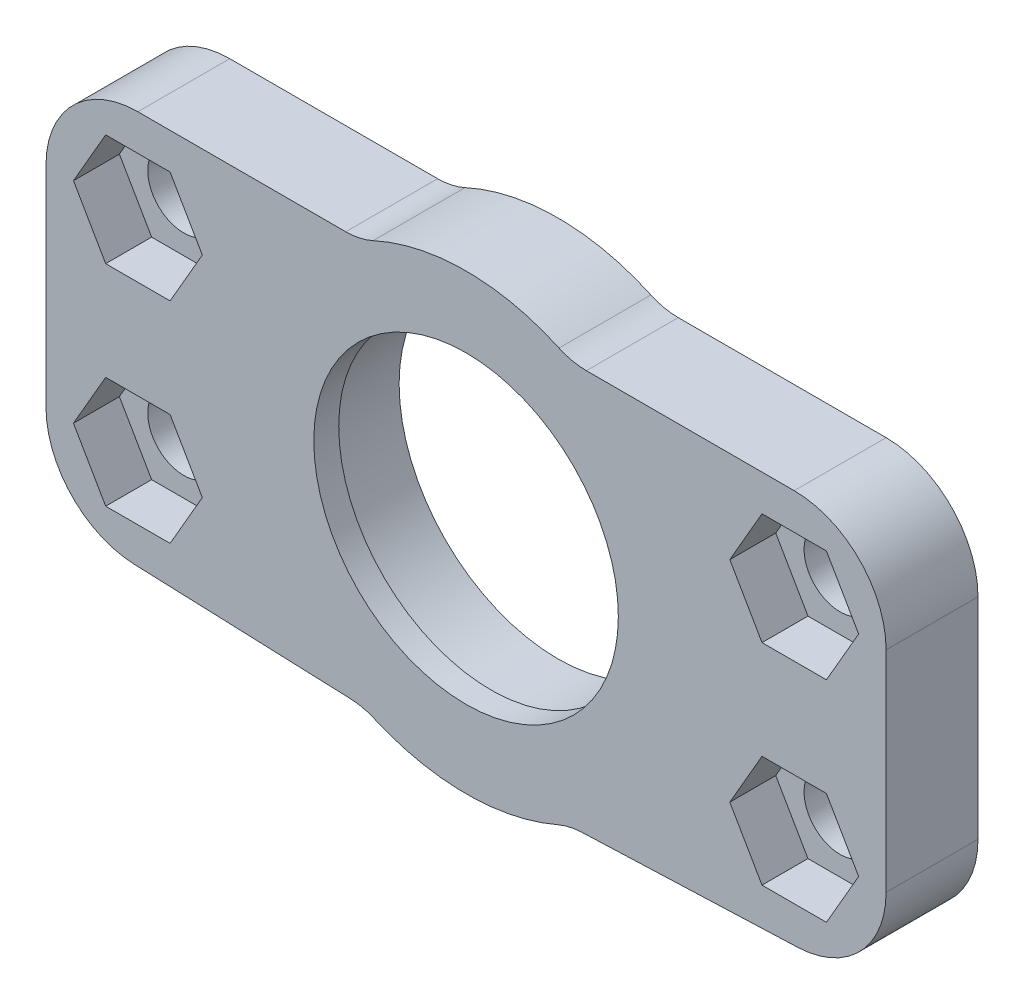
from build123d import *
from build123d.topology import SkipClean

# Parameters (mm, degrees)
SKETCH1_R           = 2.75
BOSS_EXTRUDE1_DEPTH = 7
SKETCH2_R           = 12.1
CUT_EXTRUDE1_DEPTH  = 5.1
CUT_EXTRUDE2_DEPTH  = 3.5
FILLET1_R           = 5


with BuildPart() as part:
    # Sketch1 → Boss-Extrude1 (new body)
    with BuildSketch(Plane.XY):
        with BuildLine():
            Line((24.00000152, 32.500000075), (7.00000152, 32.500000075))
            ThreePointArc((7.00000152, 32.500000075), (2.050254052, 30.449747543), (1.52e-06, 25.500000075))
            Line((1.52e-06, 25.500000075), (1.52e-06, 9.500000075))
            ThreePointArc((1.52e-06, 9.500000075), (1.956143738, 4.646187277), (6.731286856, 2.50515966))
            Line((6.731286856, 2.50515966), (24.20077069, 1.834049785))
            ThreePointArc((24.20077069, 1.834049785), (27.99401413, 0.464681908), (32.00000152, 7.5e-08))
            Line((32.00000152, 7.5e-08), (32.00000152, 5.900000075))
            ThreePointArc((32.00000152, 5.900000075), (20.40000152, 17.500000075), (32.00000152, 29.100000075))
            Line((32.00000152, 29.100000075), (32.00000152, 34.500000075))
            ThreePointArc((32.00000152, 34.500000075), (27.876895894, 33.992422577), (24.00000152, 32.500000075))
        make_face()
        with Locations((7.00000152, 25.500000075)):
            Circle(SKETCH1_R, mode=Mode.SUBTRACT)
        with Locations((7.00000152, 9.500000075)):
            Circle(SKETCH1_R, mode=Mode.SUBTRACT)
    extrude(amount=BOSS_EXTRUDE1_DEPTH)

    # Sketch2 → Cut-Extrude1 (cut)
    with BuildSketch(Plane(origin=(0, 0, 0), x_dir=(-1, 0, 0), z_dir=(0, 0, -1))):
        with Locations((-32.00000152, 17.500000075)):
            Circle(SKETCH2_R)
    extrude(amount=-CUT_EXTRUDE1_DEPTH, mode=Mode.SUBTRACT)

    # Sketch3 → Cut-Extrude2 (cut)
    with BuildSketch(Plane.XY.offset(7)):
        Polygon((4.546262876, 29.750000075), (2.092524232, 25.500000075), (4.546262876, 21.250000075), (9.453740164, 21.250000075), (11.907478808, 25.500000075), (9.453740164, 29.750000075), align=None)
        Polygon((4.546262876, 13.750000075), (2.092524232, 9.500000075), (4.546262876, 5.250000075), (9.453740164, 5.250000075), (11.907478808, 9.500000075), (9.453740164, 13.750000075), align=None)
    extrude(amount=-CUT_EXTRUDE2_DEPTH, mode=Mode.SUBTRACT)

    # Fillet1
    fillet1_edges = [part.edges().sort_by_distance(p)[0] for p in [
        (24.00000152, 32.500000075, 3.5),
        (24.20077069, 1.834049785, 3.5),
    ]]
    fillet(fillet1_edges, radius=FILLET1_R)

    # Mirror1: part across plane


with BuildPart() as part_1:
    with SkipClean():  # the faces are left unmerged after this step: merging them gives an invalid solid
        add(part.part)
        add(part.part.mirror(Plane(origin=(32.00000152, 34.500000075, 7), x_dir=(0, 0, 1), z_dir=(-1, 0, 0))))


solid = part_1.part
